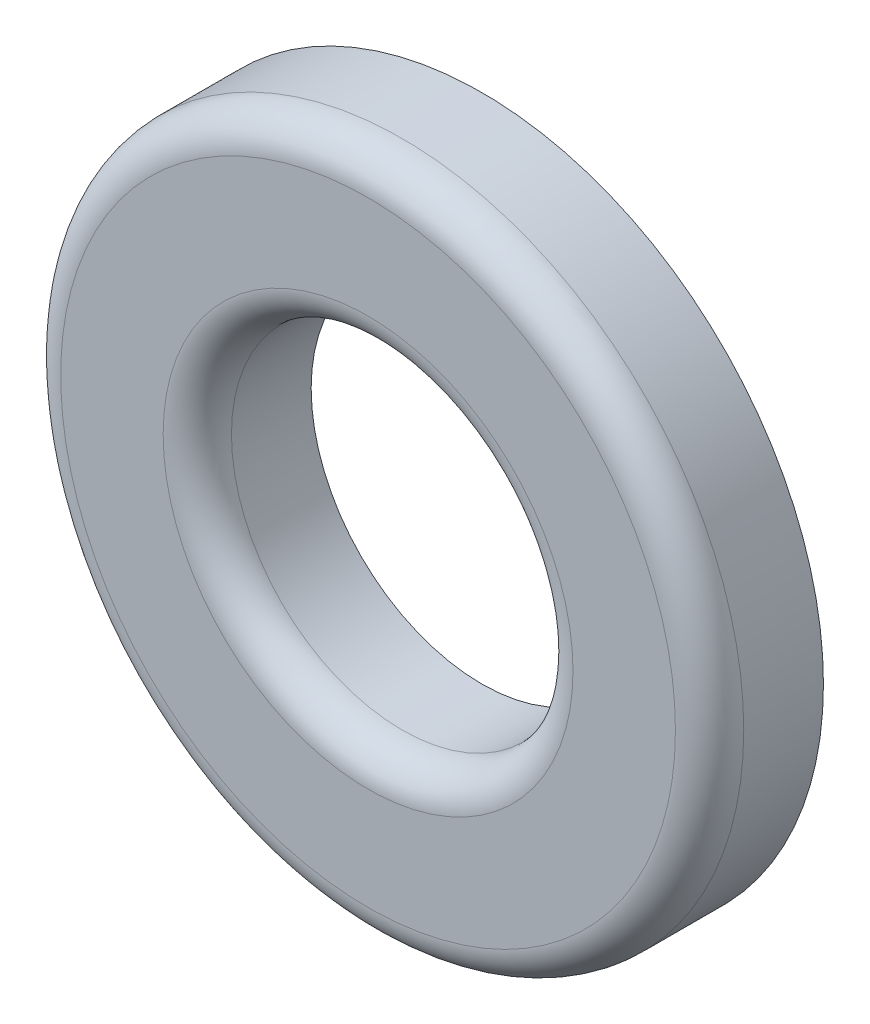
from build123d import *

# Parameters (mm, degrees)
SKETCH1_R           = 30
SKETCH1_R_2         = 15
BOSS_EXTRUDE1_DEPTH = 10
FILLET1_R           = 3


with BuildPart() as part:
    # Sketch1 → Boss-Extrude1 (new body)
    with BuildSketch(Plane.XY):
        Circle(SKETCH1_R)
        Circle(SKETCH1_R_2, mode=Mode.SUBTRACT)
    extrude(amount=BOSS_EXTRUDE1_DEPTH)

    # Fillet1
    fillet1_edges = [part.edges().sort_by_distance(p)[0] for p in [
        (-30, 0, 10),
        (-15, 0, 10),
    ]]
    fillet(fillet1_edges, radius=FILLET1_R)


solid = part.part
